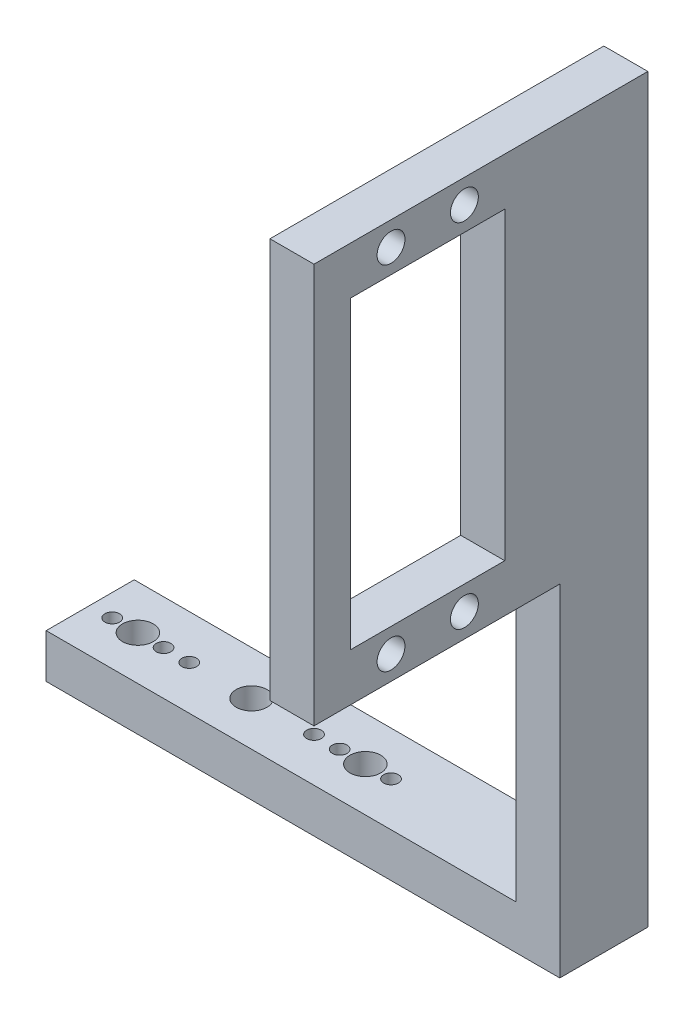
from build123d import *

# Parameters (mm, degrees)
CROQUIS1_W              = 44
CROQUIS1_H              = 12
CROQUIS1_R              = 1
CROQUIS1_R_2            = 2.1
SALIENTE_EXTRUIR1_DEPTH = 6
CROQUIS2_W              = 12
CROQUIS2_H              = 6
SALIENTE_EXTRUIR2_DEPTH = 20
CROQUIS3_R              = 1.9
CROQUIS3_W              = 21
CROQUIS3_H              = 41.5
SALIENTE_EXTRUIR3_DEPTH = 6
CROQUIS4_R              = 2.1
CROQUIS4_R_2            = 1
SALIENTE_EXTRUIR4_DEPTH = 2
CROQUIS5_R              = 2.1
CORTAR_EXTRUIR1_DEPTH   = 3.5


with BuildPart() as part:
    # Croquis1 → Saliente-Extruir1 (new body)
    with BuildSketch(Plane(origin=(0, 0, 0), x_dir=(1, 0, 0), z_dir=(0, 1, 0))):
        Rectangle(CROQUIS1_W, CROQUIS1_H)
        with Locations(Location((15.5, 0, 0), (0, 0, 270))):
            Circle(CROQUIS1_R, mode=Mode.SUBTRACT)
        with Locations(Location((0, 0, 0), (0, 0, 270))):
            Circle(CROQUIS1_R_2, mode=Mode.SUBTRACT)
        with Locations(Location((8.5, 0, 0), (0, 0, 270))):
            Circle(CROQUIS1_R, mode=Mode.SUBTRACT)
        with Locations(Location((-8.5, 0, 0), (0, 0, 270))):
            Circle(CROQUIS1_R, mode=Mode.SUBTRACT)
        with Locations(Location((-12, 0, 0), (0, 0, 270))):
            Circle(CROQUIS1_R, mode=Mode.SUBTRACT)
        with Locations(Location((-15.5, 0, 0), (0, 0, 270))):
            Circle(CROQUIS1_R, mode=Mode.SUBTRACT)
        with Locations(Location((-19, 0, 0), (0, 0, 270))):
            Circle(CROQUIS1_R, mode=Mode.SUBTRACT)
        with Locations(Location((12, 0, 0), (0, 0, 270))):
            Circle(CROQUIS1_R, mode=Mode.SUBTRACT)
        with Locations(Location((19, 0, 0), (0, 0, 270))):
            Circle(CROQUIS1_R, mode=Mode.SUBTRACT)
    extrude(amount=SALIENTE_EXTRUIR1_DEPTH)

    # Croquis2 → Saliente-Extruir2 (add)
    with BuildSketch(Plane(origin=(22, 0, 0), x_dir=(0, 0, -1), z_dir=(1, 0, 0))):
        with Locations((0, 3)):
            Rectangle(CROQUIS2_W, CROQUIS2_H)
    extrude(amount=SALIENTE_EXTRUIR2_DEPTH)

    # Croquis3 → Saliente-Extruir3 (add)
    with BuildSketch(Plane(origin=(42, 0, 0), x_dir=(0, 0, -1), z_dir=(1, 0, 0))):
        Polygon((-6, 46.5), (-6, 0), (6, 0), (6, 101), (-39.5, 101), (-39.5, 46.5), align=None)
        with Locations((-19, 97.75)):
            Circle(CROQUIS3_R, mode=Mode.SUBTRACT)
        with Locations((-29, 49.75)):
            Circle(CROQUIS3_R, mode=Mode.SUBTRACT)
        with Locations((-19, 49.75)):
            Circle(CROQUIS3_R, mode=Mode.SUBTRACT)
        with Locations((-29, 97.75)):
            Circle(CROQUIS3_R, mode=Mode.SUBTRACT)
        with Locations((-24, 73.75)):
            Rectangle(CROQUIS3_W, CROQUIS3_H, mode=Mode.SUBTRACT)
    extrude(amount=SALIENTE_EXTRUIR3_DEPTH)

    # Croquis4 → Saliente-Extruir4 (add)
    with BuildSketch(Plane.XZ):
        with Locations(Location((0, 0, 0), (0, 0, 270))):
            Circle(CROQUIS4_R)
        with Locations(Location((0, 0, 0), (0, 0, 270))):
            Circle(CROQUIS4_R_2, mode=Mode.SUBTRACT)
    extrude(amount=-SALIENTE_EXTRUIR4_DEPTH)

    # Croquis5 → Cortar-Extruir1 (cut)
    with BuildSketch(Plane(origin=(0, 6, 0), x_dir=(1, 0, 0), z_dir=(0, 1, 0))):
        with Locations(Location((-15.5, 0, 0), (0, 0, 270))):
            Circle(CROQUIS5_R)
        with Locations(Location((15.5, 0, 0), (0, 0, 270))):
            Circle(CROQUIS5_R)
    extrude(amount=-CORTAR_EXTRUIR1_DEPTH, mode=Mode.SUBTRACT)


solid = part.part
